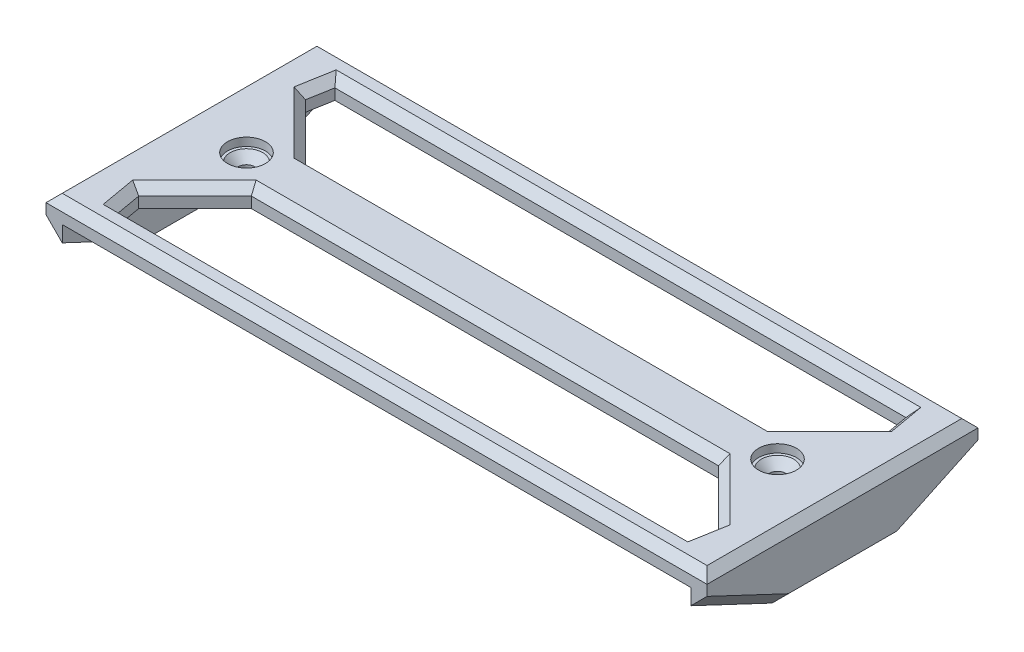
from build123d import *

# Parameters (mm, degrees)
BOSS_EXTRUDE1_DEPTH = 10
CUT_EXTRUDE3_DEPTH  = 68.292273107
CHAMFER2_SIZE       = 1.5
SKETCH2_R           = 3.5
CUT_EXTRUDE1_DEPTH  = 1.5
SKETCH3_R           = 1.5
CUT_EXTRUDE2_DEPTH  = 68.007462417
CHAMFER1_SIZE       = 1.5


with BuildPart() as part:
    # Sketch1 → Boss-Extrude1 (new, symmetric)
    with BuildSketch(Plane.XY):
        Polygon((-58, 0), (58, 0), (58, -10), (61, -7), (61, 3.5), (-61, 3.5), (-61, -7), (-58, -10), align=None)
    extrude(amount=BOSS_EXTRUDE1_DEPTH, both=True)

    # Sketch4 → section 0 of loft1
    with BuildSketch(Plane.XY.offset(-25), mode=Mode.PRIVATE) as loft1_s0:
        with BuildLine():
            Line((58, -2.928932188), (61, 0.071067812))
            Line((61, 0.071067812), (61, 3.5))
            Line((61, 3.5), (-61, 3.5))
            Line((-61, 3.5), (-61, 0.071067812))
            Line((-61, 0.071067812), (-58, -2.928932188))
            Line((-58, -2.928932188), (-58, 0))
            Line((-58, 0), (58, 0))
            Line((58, 0), (58, -2.928932188))
        make_face()
    # loft up to a face of the part (loft1)
    loft([loft1_s0.sketch, part.faces().sort_by_distance((0, 1.105125523, -10))[0]])

    # Sketch5 → section 1 of loft2
    with BuildSketch(Plane.XY.offset(25), mode=Mode.PRIVATE) as loft2_s1:
        with BuildLine():
            Line((-58, 0), (58, 0))
            Line((58, 0), (58, -2.928932188))
            Line((58, -2.928932188), (61, 0.071067812))
            Line((61, 0.071067812), (61, 3.5))
            Line((61, 3.5), (-61, 3.5))
            Line((-61, 3.5), (-61, 0.071067812))
            Line((-61, 0.071067812), (-58, -2.928932188))
            Line((-58, -2.928932188), (-58, 0))
        make_face()
    # loft from a face of the part (loft2)
    loft([part.faces().sort_by_distance((0, 1.105125523, 10))[0], loft2_s1.sketch])

    # Sketch6 → Cut-Extrude3 (cut, through all)
    with BuildSketch(Plane(origin=(0, 3.5, 0), x_dir=(1, 0, 0), z_dir=(0, 1, 0))):
        Polygon((43.107671767, 5), (-43.107671767, 5), (-53.5, 15.392328233), (-52.687543149, 20), (52.687543149, 20), (53.5, 15.392328233), align=None)
        Polygon((43.107671767, -5), (-43.107671767, -5), (-53.5, -15.392328233), (-52.687543149, -20), (52.687543149, -20), (53.5, -15.392328233), align=None)
    extrude(amount=-CUT_EXTRUDE3_DEPTH, mode=Mode.SUBTRACT)

    # Chamfer2
    chamfer2_edges = [part.edges().sort_by_distance(p)[0] for p in [
        (48.303835883, 3.5, -10.196164117),
        (53.093771575, 3.5, -17.696164117),
        (0, 3.5, -20),
        (-53.093771575, 3.5, -17.696164117),
        (-48.303835883, 3.5, -10.196164117),
        (0, 3.5, -5),
        (-53.093771575, 3.5, 17.696164117),
        (0, 3.5, 20),
        (53.093771575, 3.5, 17.696164117),
        (48.303835883, 3.5, 10.196164117),
        (0, 3.5, 5),
        (-48.303835883, 3.5, 10.196164117),
        (-61, 3.5, 0),
        (61, 3.5, 0),
        (0, 3.5, -25),
        (0, 3.5, 25),
    ]]
    chamfer(chamfer2_edges, length=CHAMFER2_SIZE)

    # Sketch2 → Cut-Extrude1 (cut)
    with BuildSketch(Plane(origin=(0, 3.5, 0), x_dir=(1, 0, 0), z_dir=(0, 1, 0))):
        with Locations(Location((49, 0, 0), (0, 0, 270))):
            Circle(SKETCH2_R)
        with Locations(Location((-49, 0, 0), (0, 0, 270))):
            Circle(SKETCH2_R)
    extrude(amount=-CUT_EXTRUDE1_DEPTH, mode=Mode.SUBTRACT)

    # Sketch3 → Cut-Extrude2 (cut, through all)
    with BuildSketch(Plane(origin=(0, 2, 0), x_dir=(1, 0, 0), z_dir=(0, 1, 0))):
        with Locations(Location((49, 0, 0), (0, 0, 180))):
            Circle(SKETCH3_R)
        with Locations(Location((-49, 0, 0), (0, 0, 180))):
            Circle(SKETCH3_R)
    extrude(amount=-CUT_EXTRUDE2_DEPTH, mode=Mode.SUBTRACT)

    # Chamfer1
    chamfer1_edges = [part.edges().sort_by_distance(p)[0] for p in [
        (50.5, 2, 0),
        (-47.5, 2, 0),
    ]]
    chamfer(chamfer1_edges, length=CHAMFER1_SIZE)


solid = part.part
